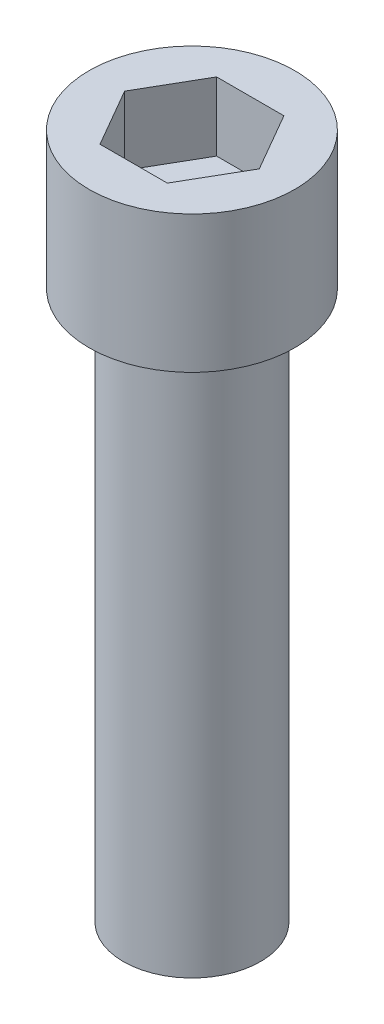
from build123d import *

# Parameters (mm, degrees)
CUT_EXTRUDE1_DEPTH = 10


with BuildPart() as part:
    # Sketch1 → Revolve1 (revolve)
    with BuildSketch(Plane.XY, mode=Mode.PRIVATE) as revolve1_sk:
        Polygon((0, -80), (10, -80), (10, 0), (15, 0), (15, 20), (0, 20), align=None)
    revolve(revolve1_sk.sketch.rotate(Axis((0, 61.691642626, 0), (0, -1, 0)), 90), axis=Axis((0, 61.691642626, 0), (0, -1, 0)))

    # Sketch2 → Cut-Extrude1 (cut)
    with BuildSketch(Plane(origin=(0, 20, 0), x_dir=(-1, 0, 0), z_dir=(0, 1, 0))):
        Polygon((-4.907477288, -8.5), (4.907477288, -8.5), (9.814954576, 0), (4.907477288, 8.5), (-4.907477288, 8.5), (-9.814954576, 0), align=None)
    extrude(amount=-CUT_EXTRUDE1_DEPTH, mode=Mode.SUBTRACT)


solid = part.part
